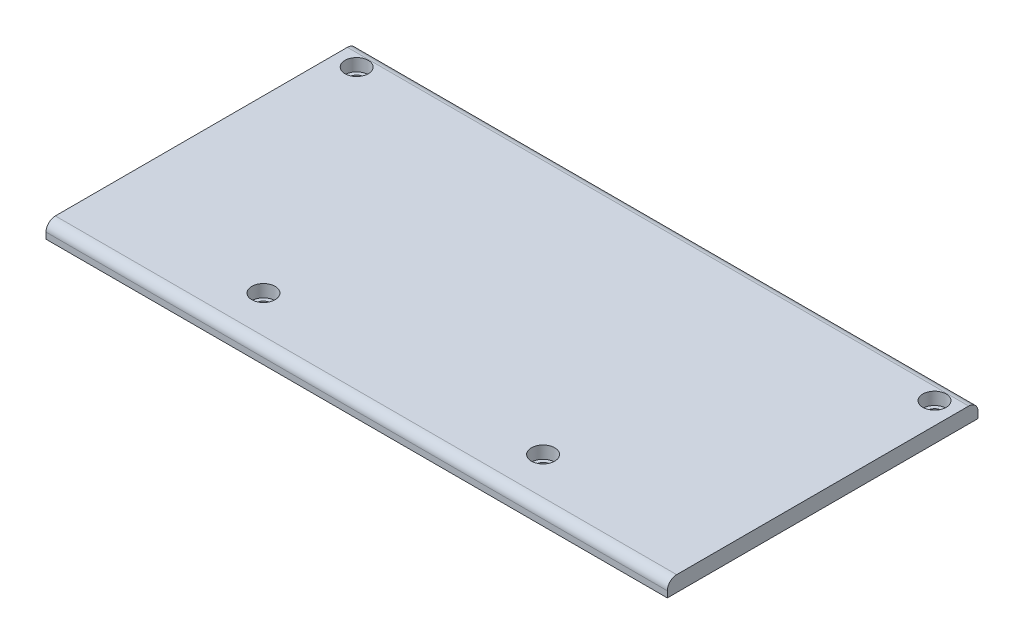
from build123d import *

# Parameters (mm, degrees)
SKETCH1_W           = 200
SKETCH1_H           = 100
BOSS_EXTRUDE1_DEPTH = 5
SKETCH2_R           = 2.5
CUT_EXTRUDE1_DEPTH  = 112.915146428
SKETCH3_R           = 3.75
CUT_EXTRUDE2_DEPTH  = 4
FILLET1_R           = 3


with BuildPart() as part:
    # Sketch1 → Boss-Extrude1 (new body)
    with BuildSketch(Plane(origin=(0, 0, 0), x_dir=(1, 0, 0), z_dir=(0, 1, 0))):
        Rectangle(SKETCH1_W, SKETCH1_H)
    extrude(amount=BOSS_EXTRUDE1_DEPTH)

    # Sketch2 → Cut-Extrude1 (cut, through all)
    with BuildSketch(Plane(origin=(0, 5, 0), x_dir=(1, 0, 0), z_dir=(0, 1, 0))):
        with Locations(Location((-93, 43, 0), (0, 0, 270))):
            Circle(SKETCH2_R)
        with Locations(Location((-45, -35, 0), (0, 0, 270))):
            Circle(SKETCH2_R)
        with Locations(Location((93, 43, 0), (0, 0, 90))):
            Circle(SKETCH2_R)
        with Locations(Location((45, -35, 0), (0, 0, 90))):
            Circle(SKETCH2_R)
    extrude(amount=-CUT_EXTRUDE1_DEPTH, mode=Mode.SUBTRACT)

    # Sketch3 → Cut-Extrude2 (cut)
    with BuildSketch(Plane(origin=(0, 5, 0), x_dir=(1, 0, 0), z_dir=(0, 1, 0))):
        with Locations(Location((-93, 43, 0), (0, 0, 270))):
            Circle(SKETCH3_R)
        with Locations(Location((-45, -35, 0), (0, 0, 270))):
            Circle(SKETCH3_R)
        with Locations(Location((45, -35, 0), (0, 0, 90))):
            Circle(SKETCH3_R)
        with Locations(Location((93, 43, 0), (0, 0, 90))):
            Circle(SKETCH3_R)
    extrude(amount=-CUT_EXTRUDE2_DEPTH, mode=Mode.SUBTRACT)

    # Fillet1
    fillet1_edges = [part.edges().sort_by_distance(p)[0] for p in [
        (0, 5, 50),
        (0, 5, -50),
    ]]
    fillet(fillet1_edges, radius=FILLET1_R)


solid = part.part
